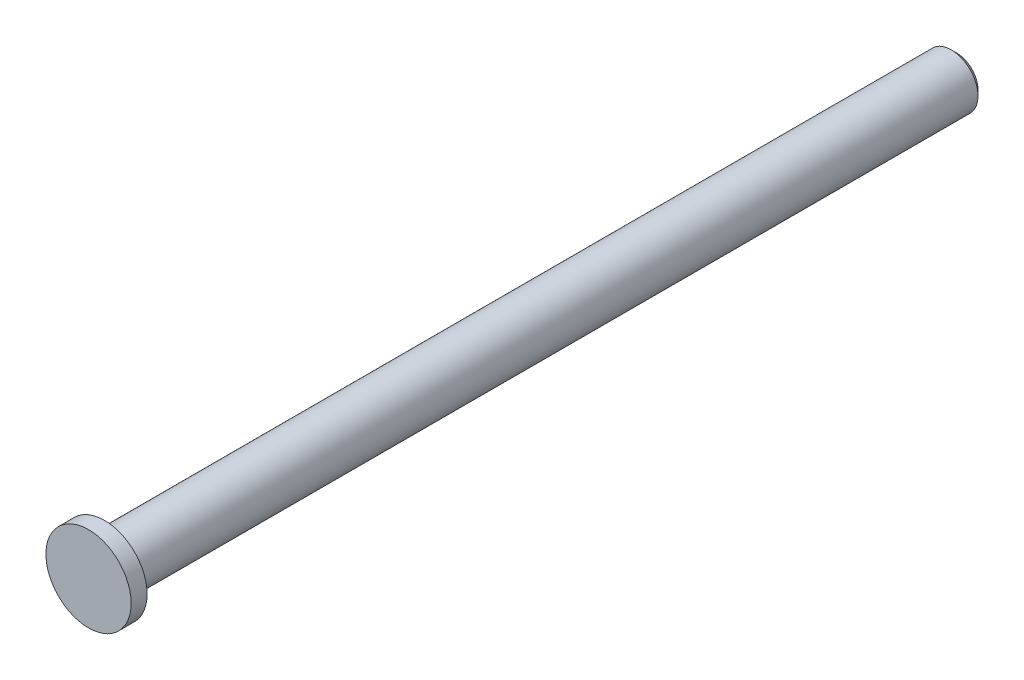
from build123d import *

# Parameters (mm, degrees)
SKETCH3_R           = 4
BOSS_EXTRUDE3_DEPTH = 1.5
SKETCH4_R           = 2.5
BOSS_EXTRUDE4_DEPTH = 80
CHAMFER2_SIZE       = 0.5


with BuildPart() as part:
    # Sketch3 → Boss-Extrude3 (new body)
    with BuildSketch(Plane.XY):
        Circle(SKETCH3_R)
    extrude(amount=BOSS_EXTRUDE3_DEPTH)

    # Sketch4 → Boss-Extrude4 (add)
    with BuildSketch(Plane(origin=(0, 0, 0), x_dir=(-1, 0, 0), z_dir=(0, 0, -1))):
        Circle(SKETCH4_R)
    extrude(amount=BOSS_EXTRUDE4_DEPTH)

    # Chamfer2
    chamfer2_edges = [part.edges().sort_by_distance(p)[0] for p in [
        (2.5, 0, -80),
    ]]
    chamfer(chamfer2_edges, length=CHAMFER2_SIZE)


solid = part.part
